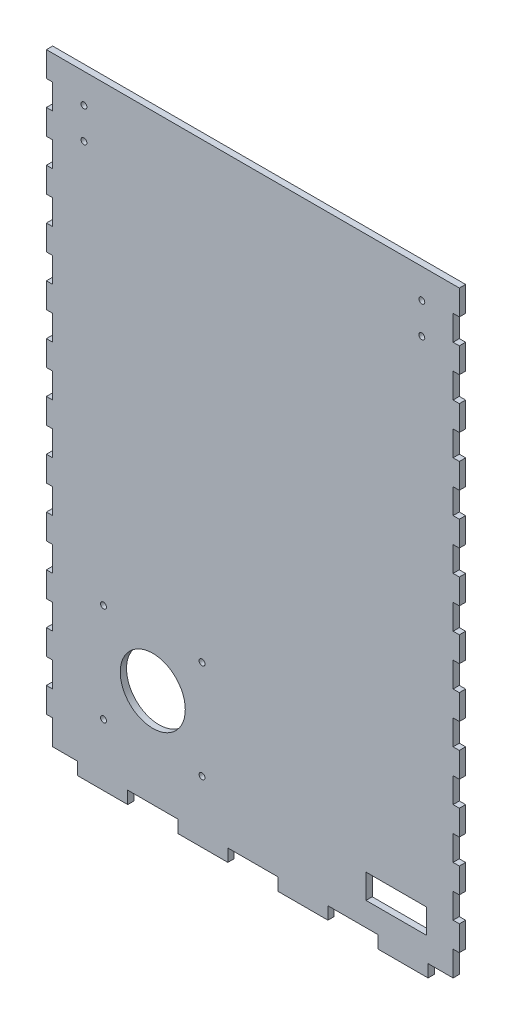
from build123d import *

# Parameters (mm, degrees)
SKETCH1_W           = 203.2
SKETCH1_H           = 304.8
BOSS_EXTRUDE1_DEPTH = 3.175
SKETCH2_W           = 3.175
SKETCH2_H           = 12.7
SKETCH2_W_2         = 25.4
SKETCH2_H_2         = 6.35
BOSS_EXTRUDE2_DEPTH = 3.175
SKETCH4_R           = 16.5
SKETCH4_R_2         = 1.5
CUT_EXTRUDE1_DEPTH  = 3.175
SKETCH5_R           = 1.5
CUT_EXTRUDE2_DEPTH  = 3.175
SKETCH7_W           = 30.575
SKETCH7_H           = 12.439028
CUT_EXTRUDE4_DEPTH  = 3.175


with BuildPart() as part:
    # Sketch1 → Boss-Extrude1 (new body)
    with BuildSketch(Plane.XY):
        with Locations((101.6, 152.4)):
            Rectangle(SKETCH1_W, SKETCH1_H)
    extrude(amount=BOSS_EXTRUDE1_DEPTH)

    # Sketch2 → Boss-Extrude2 (add)
    with BuildSketch(Plane.XY.offset(3.175)):
        with Locations((-1.5875, 298.45)):
            Rectangle(SKETCH2_W, SKETCH2_H)
        with Locations((204.7875, 298.45)):
            Rectangle(SKETCH2_W, SKETCH2_H)
        with Locations((-1.5875, 273.05)):
            Rectangle(SKETCH2_W, SKETCH2_H)
        with Locations((204.7875, 273.05)):
            Rectangle(SKETCH2_W, SKETCH2_H)
        with Locations((-1.5875, 247.65)):
            Rectangle(SKETCH2_W, SKETCH2_H)
        with Locations((204.7875, 247.65)):
            Rectangle(SKETCH2_W, SKETCH2_H)
        with Locations((-1.5875, 222.25)):
            Rectangle(SKETCH2_W, SKETCH2_H)
        with Locations((204.7875, 222.25)):
            Rectangle(SKETCH2_W, SKETCH2_H)
        with Locations((-1.5875, 196.85)):
            Rectangle(SKETCH2_W, SKETCH2_H)
        with Locations((204.7875, 196.85)):
            Rectangle(SKETCH2_W, SKETCH2_H)
        with Locations((-1.5875, 171.45)):
            Rectangle(SKETCH2_W, SKETCH2_H)
        with Locations((204.7875, 171.45)):
            Rectangle(SKETCH2_W, SKETCH2_H)
        with Locations((-1.5875, 146.05)):
            Rectangle(SKETCH2_W, SKETCH2_H)
        with Locations((204.7875, 146.05)):
            Rectangle(SKETCH2_W, SKETCH2_H)
        with Locations((-1.5875, 120.65)):
            Rectangle(SKETCH2_W, SKETCH2_H)
        with Locations((204.7875, 120.65)):
            Rectangle(SKETCH2_W, SKETCH2_H)
        with Locations((-1.5875, 95.25)):
            Rectangle(SKETCH2_W, SKETCH2_H)
        with Locations((204.7875, 95.25)):
            Rectangle(SKETCH2_W, SKETCH2_H)
        with Locations((-1.5875, 69.85)):
            Rectangle(SKETCH2_W, SKETCH2_H)
        with Locations((204.7875, 69.85)):
            Rectangle(SKETCH2_W, SKETCH2_H)
        with Locations((-1.5875, 44.45)):
            Rectangle(SKETCH2_W, SKETCH2_H)
        with Locations((204.7875, 44.45)):
            Rectangle(SKETCH2_W, SKETCH2_H)
        with Locations((-1.5875, 19.05)):
            Rectangle(SKETCH2_W, SKETCH2_H)
        with Locations((204.7875, 19.05)):
            Rectangle(SKETCH2_W, SKETCH2_H)
        with Locations((25.4, -3.175)):
            Rectangle(SKETCH2_W_2, SKETCH2_H_2)
        with Locations((76.2, -3.175)):
            Rectangle(SKETCH2_W_2, SKETCH2_H_2)
        with Locations((127, -3.175)):
            Rectangle(SKETCH2_W_2, SKETCH2_H_2)
        with Locations((177.8, -3.175)):
            Rectangle(SKETCH2_W_2, SKETCH2_H_2)
    extrude(amount=-BOSS_EXTRUDE2_DEPTH)

    # Sketch4 → Cut-Extrude1 (cut)
    with BuildSketch(Plane.XY.offset(3.175)):
        with Locations((50.8, 50)):
            Circle(SKETCH4_R)
        with Locations((25.8, 75)):
            Circle(SKETCH4_R_2)
        with Locations((75.8, 75)):
            Circle(SKETCH4_R_2)
        with Locations((75.8, 25)):
            Circle(SKETCH4_R_2)
        with Locations((25.8, 25)):
            Circle(SKETCH4_R_2)
    extrude(amount=-CUT_EXTRUDE1_DEPTH, mode=Mode.SUBTRACT)

    # Sketch5 → Cut-Extrude2 (cut)
    with BuildSketch(Plane(origin=(0, 0, 0), x_dir=(-1, 0, 0), z_dir=(0, 0, -1))):
        with Locations((-187.325, 289.8)):
            Circle(SKETCH5_R)
        with Locations((-187.325, 274.05)):
            Circle(SKETCH5_R)
        with Locations(Location((-15.875, 274.05, 0), (0, 0, 180))):
            Circle(SKETCH5_R)
        with Locations(Location((-15.875, 289.8, 0), (0, 0, 180))):
            Circle(SKETCH5_R)
    extrude(amount=-CUT_EXTRUDE2_DEPTH, mode=Mode.SUBTRACT)

    # Sketch7 → Cut-Extrude4 (cut)
    with BuildSketch(Plane.XY.offset(3.175)):
        with Locations((174.3, 18.230486)):
            Rectangle(SKETCH7_W, SKETCH7_H)
    extrude(amount=-CUT_EXTRUDE4_DEPTH, mode=Mode.SUBTRACT)


solid = part.part
